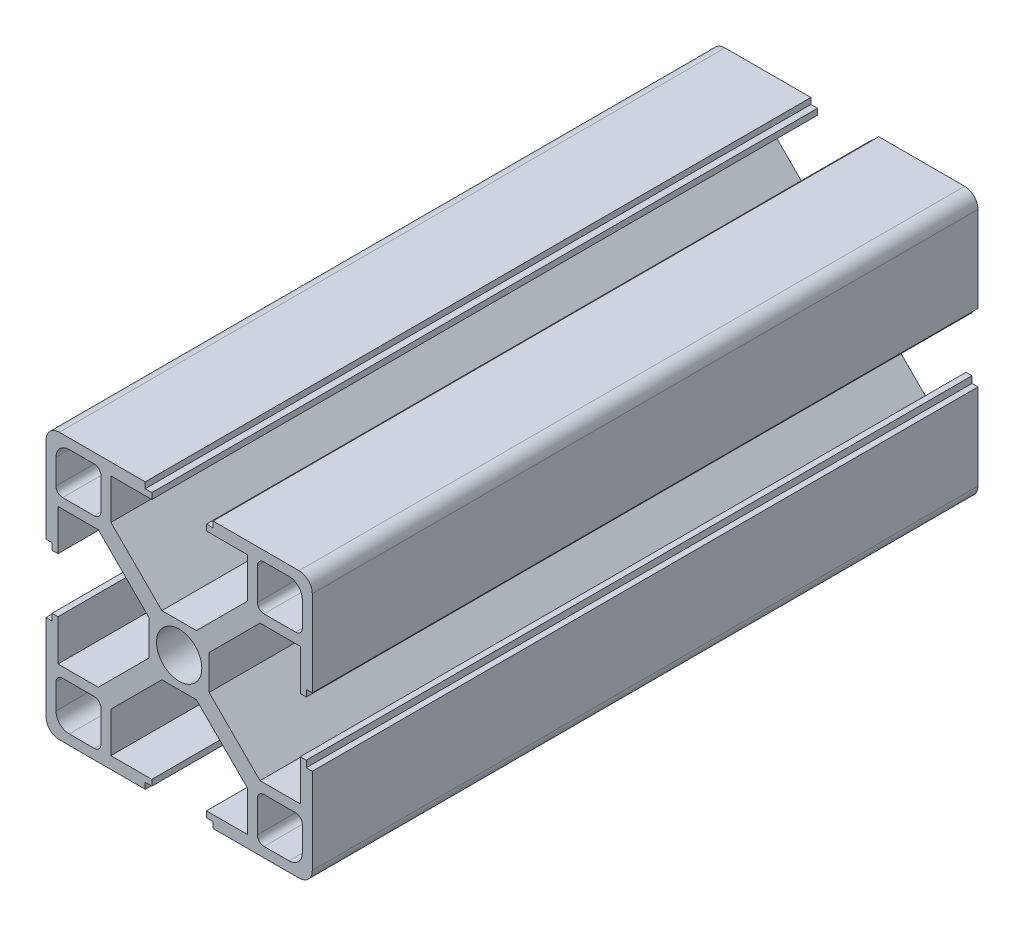
from build123d import *

# Parameters (mm, degrees)
SKETCH_1_W                       = 40
SKETCH_1_H                       = 40
EXTRUDE_1_DEPTH                  = 100
SKETCH_2_R                       = 3.4
CUT_EXTRUDE_1_DEPTH              = 104.923048454
PATTERN_CIRCULAR_1_COUNT         = 4
FILLET_1_R                       = 2
SKETCH_4_W                       = 6.75
SKETCH_4_H                       = 6.75
CUT_EXTRUDE_2_DEPTH              = 104.923048454
FILLET_2_R                       = 1
FILLET_4_R                       = 2
PATTERN_CIRCULAR_2_COUNT         = 4
FILLET_2_OF_PATTERN_CIRCULAR_2_R = 1
FILLET_4_OF_PATTERN_CIRCULAR_2_R = 2


with BuildPart() as part:
    # 草图1 → 凸台-拉伸1 (new body)
    with BuildSketch(Plane.XY):
        Rectangle(SKETCH_1_W, SKETCH_1_H)
    extrude(amount=EXTRUDE_1_DEPTH)

    # 草图2 → 切除-拉伸1 (cut, through all)
    with BuildSketch(Plane.XY.offset(100)):
        Polygon((-20, -5.1), (-19.1, -5.1), (-19.1, -4.1), (-18.2, -4.1), (-18.2, -10.25), (-12.15, -10.25), (-4.5, -2.6), (-4.5, 2.6), (-12.15, 10.25), (-18.2, 10.25), (-18.2, 4.1), (-19.1, 4.1), (-19.1, 5.1), (-20, 5.1), align=None)
        Circle(SKETCH_2_R)
    cut_extrude_1 = extrude(amount=-CUT_EXTRUDE_1_DEPTH, mode=Mode.SUBTRACT)

    # 阵列(圆周)1: 切除-拉伸1 ×4 about axis
    pattern_circular_1_axis = Axis((0, 0, 0), (0, 0, 1))
    for i in range(1, PATTERN_CIRCULAR_1_COUNT):
        add(cut_extrude_1.rotate(pattern_circular_1_axis, i * 360 / PATTERN_CIRCULAR_1_COUNT), mode=Mode.SUBTRACT)

    # 圆角1
    fillet_1_edges = [part.edges().sort_by_distance(p)[0] for p in [
        (-20, -20, 50),
        (20, -20, 50),
        (20, 20, 50),
        (-20, 20, 50),
    ]]
    fillet(fillet_1_edges, radius=FILLET_1_R)

    # 草图4 → 切除-拉伸2 (cut, symmetric)
    with BuildSketch(Plane.XY.offset(100)):
        with Locations((-15.125, 15.125)):
            Rectangle(SKETCH_4_W, SKETCH_4_H)
    cut_extrude_2 = extrude(amount=CUT_EXTRUDE_2_DEPTH, both=True, mode=Mode.SUBTRACT)

    # 圆角2
    fillet_2_edges = [part.edges().sort_by_distance(p)[0] for p in [
        (-11.75, 18.5, 50),
        (-11.75, 11.75, 50),
        (-18.5, 11.75, 50),
    ]]
    fillet(fillet_2_edges, radius=FILLET_2_R)

    # 圆角4
    fillet_4_edges = [part.edges().sort_by_distance(p)[0] for p in [
        (-18.5, 18.5, 50),
    ]]
    fillet(fillet_4_edges, radius=FILLET_4_R)

    # 阵列(圆周)2: 切除-拉伸2 ×4 about axis
    pattern_circular_2_axis = Axis((0, 0, 0), (0, 0, 1))
    for i in range(1, PATTERN_CIRCULAR_2_COUNT):
        add(cut_extrude_2.rotate(pattern_circular_2_axis, i * 360 / PATTERN_CIRCULAR_2_COUNT), mode=Mode.SUBTRACT)

    # 圆角2 of 阵列(圆周)2
    fillet_2_of_pattern_circular_2_edges = [part.edges().sort_by_distance(p)[0] for p in [
        (-18.5, -11.75, 50),
        (-11.75, -11.75, 50),
        (-11.75, -18.5, 50),
        (11.75, -18.5, 50),
        (11.75, -11.75, 50),
        (18.5, -11.75, 50),
        (18.5, 11.75, 50),
        (11.75, 11.75, 50),
        (11.75, 18.5, 50),
    ]]
    fillet(fillet_2_of_pattern_circular_2_edges, radius=FILLET_2_OF_PATTERN_CIRCULAR_2_R)

    # 圆角4 of 阵列(圆周)2
    fillet_4_of_pattern_circular_2_edges = [part.edges().sort_by_distance(p)[0] for p in [
        (-18.5, -18.5, 50),
        (18.5, -18.5, 50),
        (18.5, 18.5, 50),
    ]]
    fillet(fillet_4_of_pattern_circular_2_edges, radius=FILLET_4_OF_PATTERN_CIRCULAR_2_R)


solid = part.part
